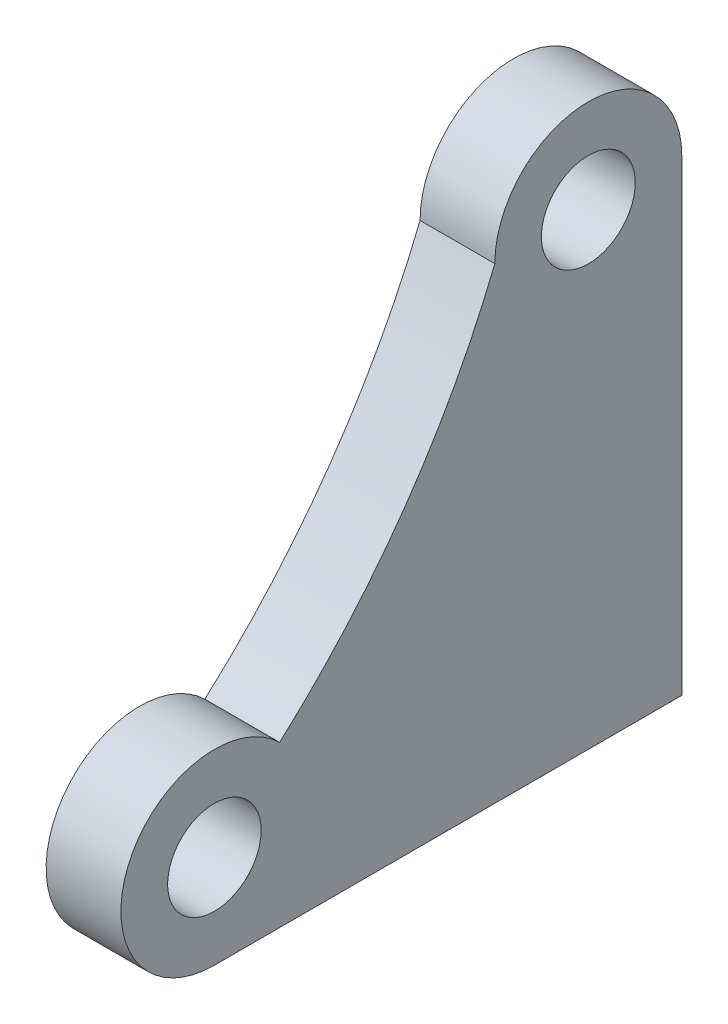
from build123d import *

# Parameters (mm, degrees)
CROQUIS3_R              = 2.5103265
CROQUIS3_R_2            = 2.5
SALIENTE_EXTRUIR1_DEPTH = 4


with BuildPart() as part:
    # Croquis3 → Saliente-Extruir1 (new body)
    with BuildSketch(Plane(origin=(0, 0, 0), x_dir=(0, 0, -1), z_dir=(1, 0, 0))):
        with BuildLine():
            Line((5, 0), (5, -25))
            Line((5, -25), (-20, -25))
            ThreePointArc((-20, -25), (-24.631788644, -18.116775648), (-16.510921132, -16.418613585))
            ThreePointArc((-16.510921132, -16.418613585), (-9.814593541, -8.868938988), (-5, 0))
            ThreePointArc((-5, 0), (0, 5), (5, 0))
        make_face()
        Circle(CROQUIS3_R, mode=Mode.SUBTRACT)
        with Locations((-20, -20)):
            Circle(CROQUIS3_R_2, mode=Mode.SUBTRACT)
    extrude(amount=SALIENTE_EXTRUIR1_DEPTH)


solid = part.part
